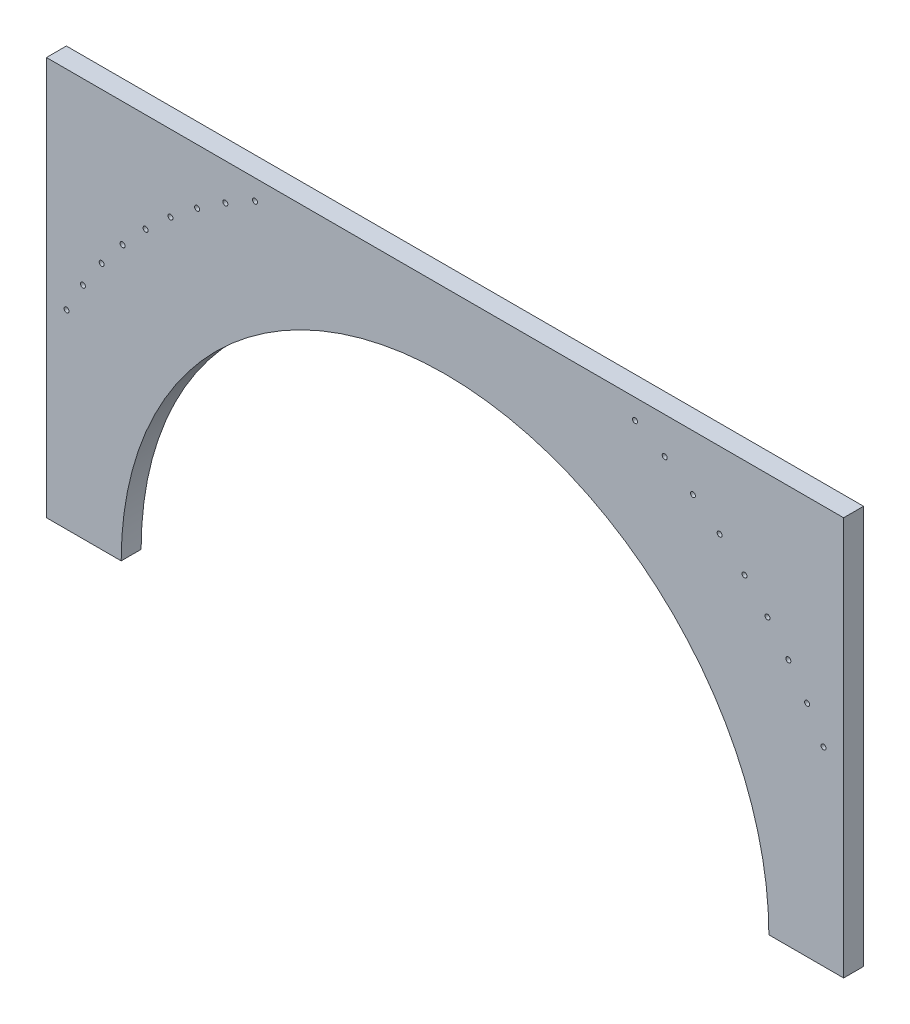
from build123d import *

# Parameters (mm, degrees)
BOSS_EXTRU_1_DEPTH      = 2
ESQUISSE2_R             = 0.25
ENL_V_MAT_EXTRU_1_DEPTH = 2


with BuildPart() as part:
    # Esquisse1 → Boss.-Extru.1 (new body)
    with BuildSketch(Plane.XY):
        with BuildLine():
            Line((40, 0), (40, 40))
            Line((40, 40), (-40, 40))
            Line((-40, 40), (-40, 0))
            Line((-40, 0), (-32.5, 0))
            ThreePointArc((-32.5, 0), (0, 32.5), (32.5, 0))
            Line((32.5, 0), (40, 0))
        make_face()
    extrude(amount=BOSS_EXTRU_1_DEPTH)

    # Esquisse2 → Enlèv. mat.-Extru.1 (cut)
    with BuildSketch(Plane.XY.offset(2)):
        with Locations((-37.981453947, 19.069849399)):
            Circle(ESQUISSE2_R)
        with Locations((-36.335546301, 22.04491041)):
            Circle(ESQUISSE2_R)
        with Locations((-34.457091159, 24.878883995)):
            Circle(ESQUISSE2_R)
        with Locations((-32.358110634, 27.553632723)):
            Circle(ESQUISSE2_R)
        with Locations((-30.0520382, 30.0520382)):
            Circle(ESQUISSE2_R)
        with Locations((-27.553632723, 32.358110634)):
            Circle(ESQUISSE2_R)
        with Locations((-24.878883995, 34.457091159)):
            Circle(ESQUISSE2_R)
        with Locations((-22.04491041, 36.335546301)):
            Circle(ESQUISSE2_R)
        with Locations((-19.069849399, 37.981453947)):
            Circle(ESQUISSE2_R)
        with Locations(Location((19.069849399, 37.981453947, 0), (0, 0, 180))):
            Circle(ESQUISSE2_R)
        with Locations(Location((22.04491041, 36.335546301, 0), (0, 0, 180))):
            Circle(ESQUISSE2_R)
        with Locations(Location((24.878883995, 34.457091159, 0), (0, 0, 180))):
            Circle(ESQUISSE2_R)
        with Locations(Location((27.553632723, 32.358110634, 0), (0, 0, 180))):
            Circle(ESQUISSE2_R)
        with Locations(Location((30.0520382, 30.0520382, 0), (0, 0, 180))):
            Circle(ESQUISSE2_R)
        with Locations(Location((32.358110634, 27.553632723, 0), (0, 0, 180))):
            Circle(ESQUISSE2_R)
        with Locations(Location((34.457091159, 24.878883995, 0), (0, 0, 180))):
            Circle(ESQUISSE2_R)
        with Locations(Location((36.335546301, 22.04491041, 0), (0, 0, 180))):
            Circle(ESQUISSE2_R)
        with Locations(Location((37.981453947, 19.069849399, 0), (0, 0, 180))):
            Circle(ESQUISSE2_R)
    extrude(amount=-ENL_V_MAT_EXTRU_1_DEPTH, mode=Mode.SUBTRACT)


solid = part.part
